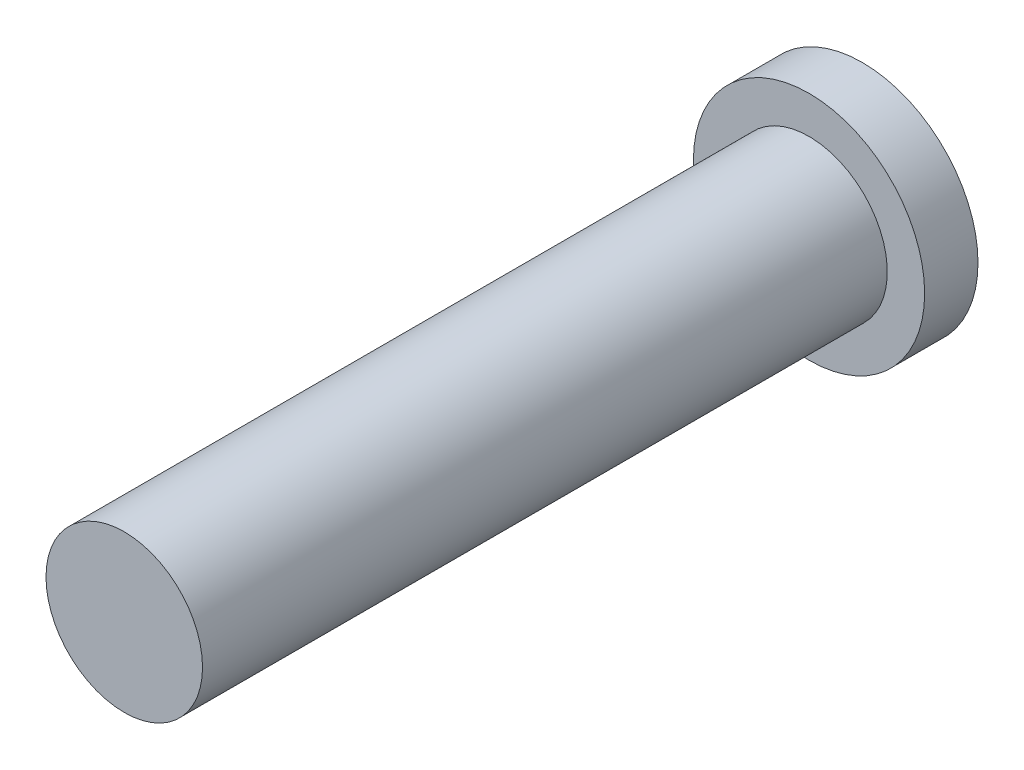
from build123d import *

# Parameters (mm, degrees)
SKETCH1_R           = 4.4
BOSS_EXTRUDE1_DEPTH = 41.5
SKETCH2_R           = 6.5
BOSS_EXTRUDE2_DEPTH = 3


with BuildPart() as part:
    # Sketch1 → Boss-Extrude1 (new body)
    with BuildSketch(Plane.XY):
        Circle(SKETCH1_R)
    extrude(amount=BOSS_EXTRUDE1_DEPTH)

    # Sketch2 → Boss-Extrude2 (add)
    with BuildSketch(Plane(origin=(0, 0, 0), x_dir=(-1, 0, 0), z_dir=(0, 0, -1))):
        Circle(SKETCH2_R)
    extrude(amount=-BOSS_EXTRUDE2_DEPTH)


solid = part.part
